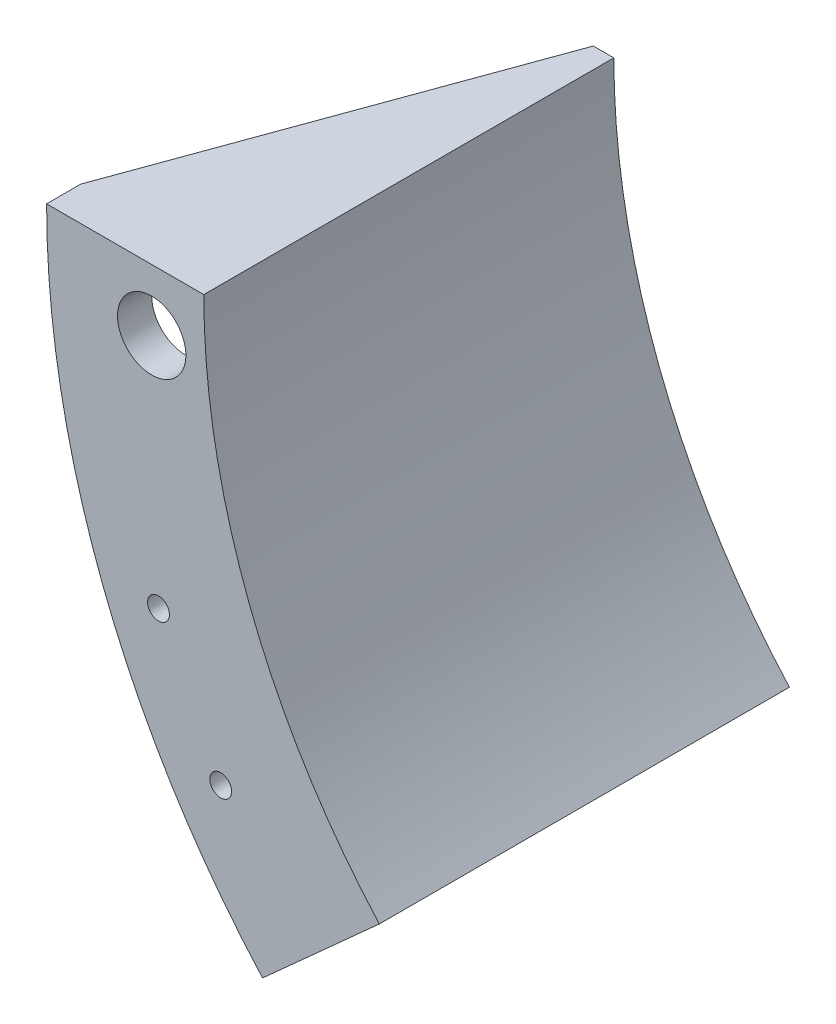
from build123d import *

# Parameters (mm, degrees)
EXTRUDE_1_DEPTH     = 60
EXTRUDE_2_DEPTH     = 5
SKETCH_4_R          = 1.6
CUT_EXTRUDE_1_DEPTH = 158.885383869
EXTRUDE_3_DEPTH     = 4
EXTRUDE_4_DEPTH     = 4
SKETCH_7_R          = 5
CUT_EXTRUDE_2_DEPTH = 158.885383869


with BuildPart() as part:
    # 草图1 → 凸台-拉伸1 (new body)
    with BuildSketch(Plane.XY):
        with BuildLine():
            Line((-100, 0), (-103, 0))
            ThreePointArc((-103, 0), (-96.158783929, -36.911898803), (-76.543917024, -68.920452455))
            Line((-76.543917024, -68.920452455), (-74.314482548, -66.913060636))
            ThreePointArc((-74.314482548, -66.913060636), (-93.35804265, -35.836794955), (-100, 0))
        make_face()
    extrude(amount=EXTRUDE_1_DEPTH)

    # 草图2 → 凸台-拉伸2 (add)
    with BuildSketch(Plane.XY.offset(60)):
        with BuildLine():
            Line((-75.335122837, -67.83204928), (-91.406813534, -82.303064582))
            ThreePointArc((-91.406813534, -82.303064582), (-114.830392459, -44.079257794), (-123, 0))
            Line((-123, 0), (-101.373406978, 0))
            ThreePointArc((-101.373406978, 0), (-94.640228522, -36.328979997), (-75.335122837, -67.83204928))
        make_face()
    extrude(amount=-EXTRUDE_2_DEPTH)

    # 草图4 → 切除-拉伸1 (cut, through all)
    with BuildSketch(Plane(origin=(0, 0, 55), x_dir=(-1, 0, 0), z_dir=(0, 0, -1))):
        with Locations((97.525531058, -60.940715387)):
            Circle(SKETCH_4_R)
        with Locations((106.626143275, -43.079758243)):
            Circle(SKETCH_4_R)
    extrude(amount=-CUT_EXTRUDE_1_DEPTH, mode=Mode.SUBTRACT)

    # 草图5 → 凸台-拉伸3 (add)
    with BuildSketch(Plane(origin=(0, 0, 0), x_dir=(1, 0, 0), z_dir=(0, 1, 0))):
        Polygon((-103, 0), (-123, -55), (-100, -55), (-100, 0), align=None)
    extrude(amount=-EXTRUDE_3_DEPTH)

    # 草图6 → 凸台-拉伸4 (add)
    with BuildSketch(Plane(origin=(0, 0, 0), x_dir=(0, 0, -1), z_dir=(0.6691306063588633, -0.7431448254773898, 0))):
        Polygon((-55, -123), (0, -103), (0, -100), (-55, -100), align=None)
    extrude(amount=-EXTRUDE_4_DEPTH)

    # 草图7 → 切除-拉伸2 (cut, through all)
    with BuildSketch(Plane(origin=(0, 0, 55), x_dir=(-1, 0, 0), z_dir=(0, 0, -1))):
        with Locations((107.624346688, -9)):
            Circle(SKETCH_7_R)
    extrude(amount=-CUT_EXTRUDE_2_DEPTH, mode=Mode.SUBTRACT)


solid = part.part
